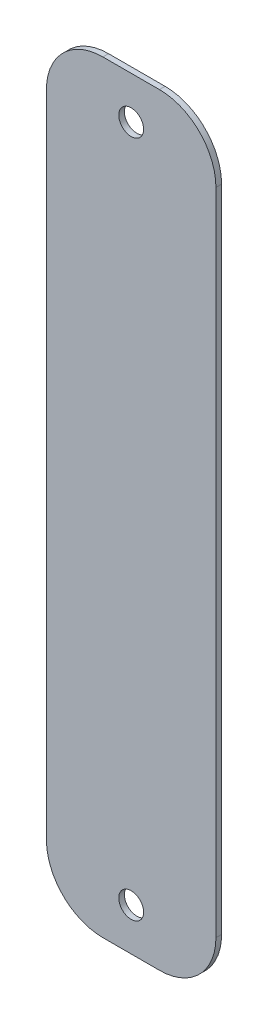
from build123d import *

# Parameters (mm, degrees)
SKETCH_1_W      = 60
SKETCH_1_H      = 270
SKETCH_1_R      = 4.4
EXTRUDE_1_DEPTH = 2
FILLET_1_R      = 20


with BuildPart() as part:
    # Эскиз1 → Бобышка-Вытянуть1 (new body)
    with BuildSketch(Plane.XY):
        Rectangle(SKETCH_1_W, SKETCH_1_H)
        with Locations((0, 120)):
            Circle(SKETCH_1_R, mode=Mode.SUBTRACT)
        with Locations(Location((0, -120, 0), (0, 0, 180))):
            Circle(SKETCH_1_R, mode=Mode.SUBTRACT)
    extrude(amount=EXTRUDE_1_DEPTH)

    # Скругление1
    fillet_1_edges = [part.edges().sort_by_distance(p)[0] for p in [
        (30, -135, 1),
        (-30, -135, 1),
        (-30, 135, 1),
        (30, 135, 1),
    ]]
    fillet(fillet_1_edges, radius=FILLET_1_R)


solid = part.part
